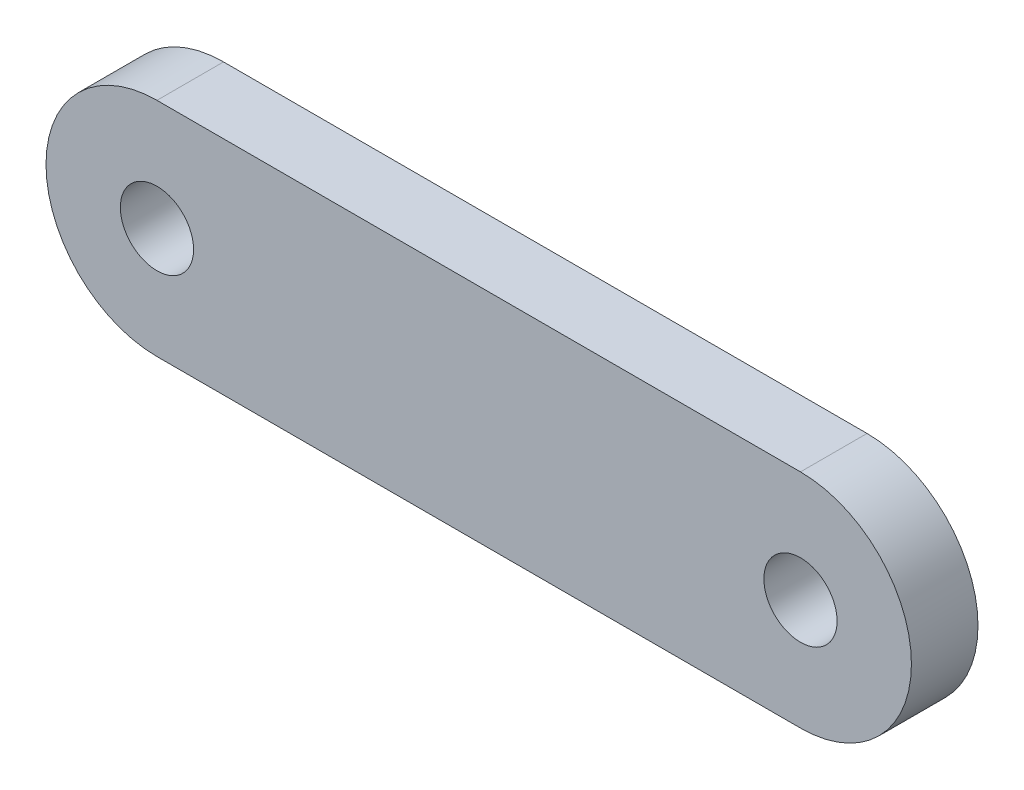
from build123d import *

# Parameters (mm, degrees)
SKETCH_1_R      = 1.65
EXTRUDE_1_DEPTH = 3


with BuildPart() as part:
    # 草图1 → 凸台-拉伸1 (new body)
    with BuildSketch(Plane.XY):
        with BuildLine():
            Line((0, 0), (29, 0))
            ThreePointArc((29, 0), (34, -5), (29, -10))
            Line((29, -10), (0, -10))
            ThreePointArc((0, -10), (-5, -5), (0, 0))
        make_face()
        with Locations((0, -5)):
            Circle(SKETCH_1_R, mode=Mode.SUBTRACT)
        with Locations((29, -5)):
            Circle(SKETCH_1_R, mode=Mode.SUBTRACT)
    extrude(amount=EXTRUDE_1_DEPTH)


solid = part.part
